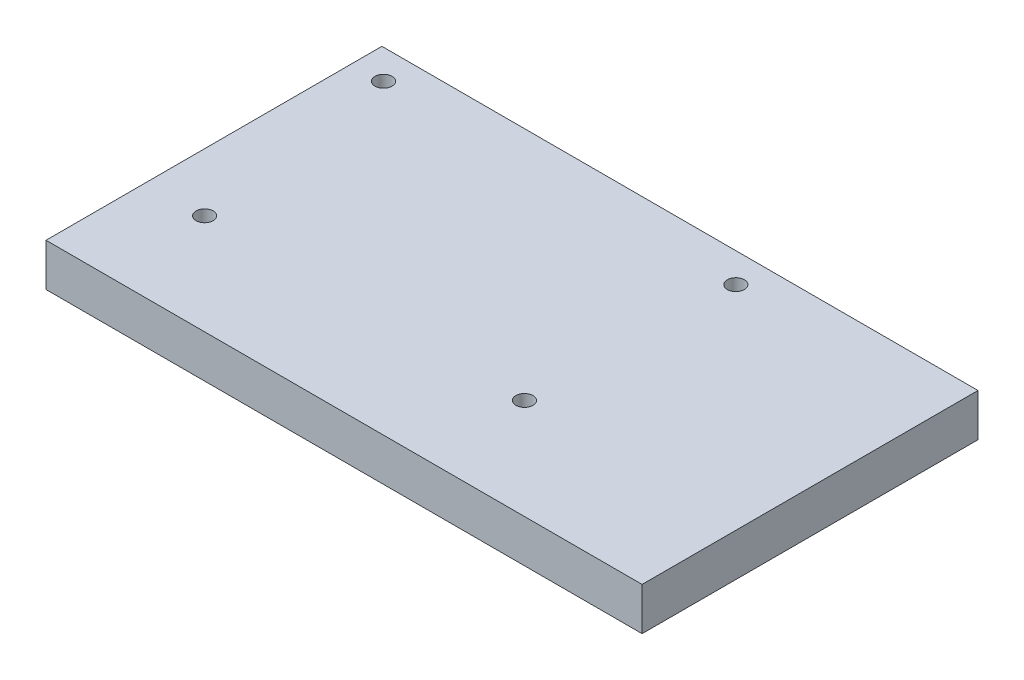
from build123d import *

# Parameters (mm, degrees)
SKETCH1_W           = 139.668592666
SKETCH1_H           = 78.706248418
BOSS_EXTRUDE1_DEPTH = 10
SKETCH2_R           = 2
CUT_EXTRUDE1_DEPTH  = 161.629976398


with BuildPart() as part:
    # Sketch1 → Boss-Extrude1 (new body)
    with BuildSketch(Plane(origin=(0, 0, 0), x_dir=(1, 0, 0), z_dir=(0, 1, 0))):
        with Locations((69.834296333, -39.353124209)):
            Rectangle(SKETCH1_W, SKETCH1_H)
    extrude(amount=BOSS_EXTRUDE1_DEPTH)

    # Sketch2 → Cut-Extrude1 (cut, through all)
    with BuildSketch(Plane(origin=(0, 0, 0), x_dir=(1, 0, 0), z_dir=(0, 1, 0))):
        with Locations(Location((88.556468701, -55.161238165, 0), (0, 0, 270))):
            Circle(SKETCH2_R)
        with Locations(Location((89.826468701, -6.901238165, 0), (0, 0, 270))):
            Circle(SKETCH2_R)
        with Locations(Location((13.626468701, -55.161238165, 0), (0, 0, 270))):
            Circle(SKETCH2_R)
        with Locations(Location((7.276468701, -6.901238165, 0), (0, 0, 270))):
            Circle(SKETCH2_R)
    extrude(amount=CUT_EXTRUDE1_DEPTH, mode=Mode.SUBTRACT)


solid = part.part
